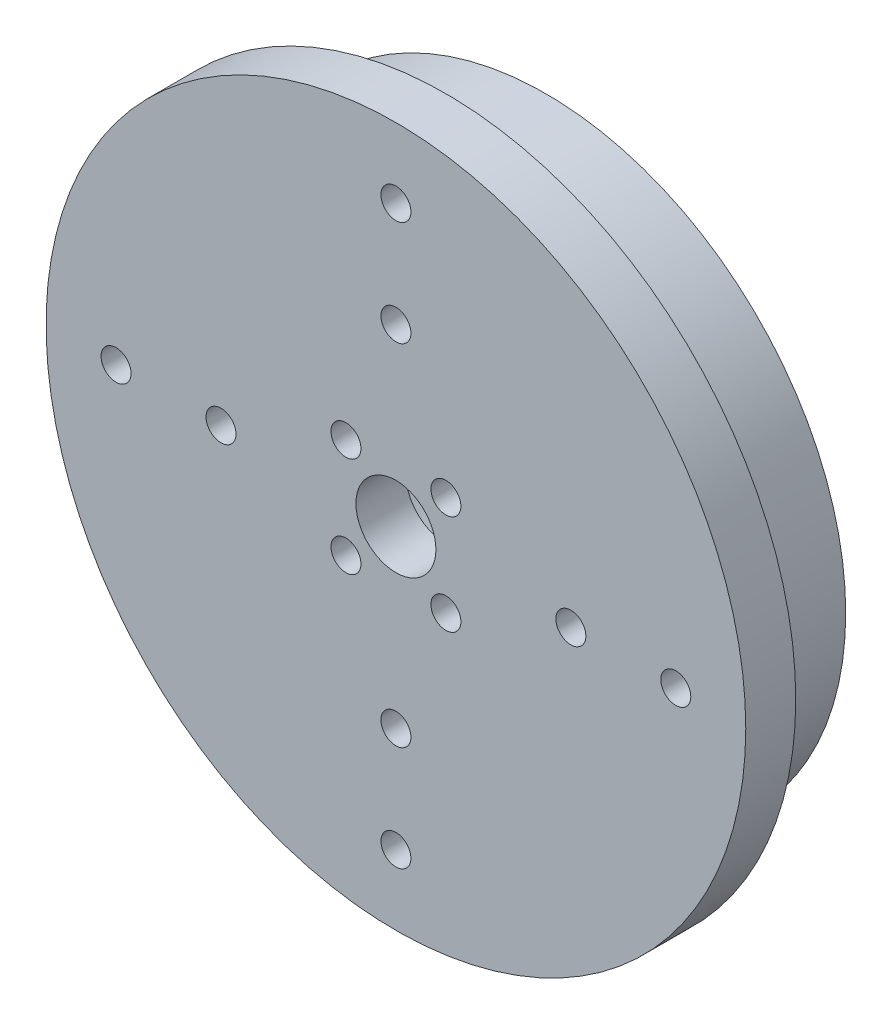
from build123d import *
from build123d.topology import SkipClean

# Parameters (mm, degrees)
SKETCH_1_R          = 35
SKETCH_1_R_2        = 30
SKETCH_1_R_3        = 1.5
SKETCH_1_R_4        = 26
SKETCH_1_R_5        = 20
SKETCH_1_R_6        = 15
SKETCH_1_R_7        = 12.5
EXTRUDE_1_DEPTH     = 5
EXTRUDE_START       = 10
SKETCH_2_R          = 30
SKETCH_2_R_2        = 26
SKETCH_2_R_3        = 1.5
SKETCH_2_R_4        = 20
SKETCH_2_R_5        = 15
EXTRUDE_2_DEPTH     = 10
SKETCH_3_R          = 4
SKETCH_3_R_2        = 1.5
CUT_EXTRUDE_1_DEPTH = 10


with BuildPart() as part:
    # 草图1 → 凸台-拉伸1 (new body)
    # profile 1 of 6: a face of its own
    with BuildSketch(Plane.XY):
        Circle(SKETCH_1_R)
        Circle(SKETCH_1_R_2, mode=Mode.SUBTRACT)
    # profile 2 of 6: a face of its own
    with BuildSketch(Plane.XY):
        Circle(SKETCH_1_R_2)
        with Locations((-28, 0)):
            Circle(SKETCH_1_R_3, mode=Mode.SUBTRACT)
        with Locations((0, -28)):
            Circle(SKETCH_1_R_3, mode=Mode.SUBTRACT)
        with Locations((28, 0)):
            Circle(SKETCH_1_R_3, mode=Mode.SUBTRACT)
        with Locations((0, 28)):
            Circle(SKETCH_1_R_3, mode=Mode.SUBTRACT)
        Circle(SKETCH_1_R_4, mode=Mode.SUBTRACT)
    # profile 3 of 6: a face of its own
    with BuildSketch(Plane.XY):
        Circle(SKETCH_1_R_4)
        Circle(SKETCH_1_R_5, mode=Mode.SUBTRACT)
    # profile 4 of 6: a face of its own
    with BuildSketch(Plane.XY):
        Circle(SKETCH_1_R_5)
        with Locations((-17.5, 0)):
            Circle(SKETCH_1_R_3, mode=Mode.SUBTRACT)
        with Locations((0, -17.5)):
            Circle(SKETCH_1_R_3, mode=Mode.SUBTRACT)
        with Locations((17.5, 0)):
            Circle(SKETCH_1_R_3, mode=Mode.SUBTRACT)
        with Locations((0, 17.5)):
            Circle(SKETCH_1_R_3, mode=Mode.SUBTRACT)
        Circle(SKETCH_1_R_6, mode=Mode.SUBTRACT)
    # profile 5 of 6: a face of its own
    with BuildSketch(Plane.XY):
        Circle(SKETCH_1_R_6)
        Circle(SKETCH_1_R_7, mode=Mode.SUBTRACT)
    # profile 6 of 6: a face of its own
    with BuildSketch(Plane.XY):
        Circle(SKETCH_1_R_7)
    extrude(amount=EXTRUDE_1_DEPTH)

    # 草图2 → 凸台-拉伸2 (add)
    # profile 1 of 2: a face of its own
    with SkipClean():  # the faces are left unmerged after this step: merging them gives an invalid solid
        with BuildSketch(Plane(origin=(0, 0, 0), x_dir=(-1, 0, 0), z_dir=(0, 0, -1)).offset(EXTRUDE_START)):
            with Locations(Location((0, 0, 0), (0, 0, 180))):
                Circle(SKETCH_2_R)
            Circle(SKETCH_2_R_2, mode=Mode.SUBTRACT)
            with Locations((0, -28)):
                Circle(SKETCH_2_R_3, mode=Mode.SUBTRACT)
            with Locations((0, 28)):
                Circle(SKETCH_2_R_3, mode=Mode.SUBTRACT)
            with Locations((-28, 0)):
                Circle(SKETCH_2_R_3, mode=Mode.SUBTRACT)
            with Locations((28, 0)):
                Circle(SKETCH_2_R_3, mode=Mode.SUBTRACT)
        # profile 2 of 2: a face of its own
        with BuildSketch(Plane(origin=(0, 0, 0), x_dir=(-1, 0, 0), z_dir=(0, 0, -1)).offset(EXTRUDE_START)):
            with Locations(Location((0, 0, 0), (0, 0, 180))):
                Circle(SKETCH_2_R_4)
            Circle(SKETCH_2_R_5, mode=Mode.SUBTRACT)
            with Locations((17.5, 0)):
                Circle(SKETCH_2_R_3, mode=Mode.SUBTRACT)
            with Locations((-17.5, 0)):
                Circle(SKETCH_2_R_3, mode=Mode.SUBTRACT)
            with Locations((0, 17.5)):
                Circle(SKETCH_2_R_3, mode=Mode.SUBTRACT)
            with Locations((0, -17.5)):
                Circle(SKETCH_2_R_3, mode=Mode.SUBTRACT)
        extrude(amount=-EXTRUDE_2_DEPTH)

    # 草图3 → 切除-拉伸1 (cut)
    with SkipClean():  # the faces are left unmerged after this step: merging them gives an invalid solid
        with BuildSketch(Plane(origin=(0, 0, 0), x_dir=(-1, 0, 0), z_dir=(0, 0, -1))):
            with BuildLine():
                ThreePointArc((-3.5, 5), (-6.060660172, 6.060660172), (-5, 3.5))
                Line((-5, 3.5), (-5, 5))
                Line((-5, 5), (-3.5, 5))
            make_face()
            with BuildLine():
                Line((-5, 5), (-5, 3.5))
                ThreePointArc((-5, 3.5), (-3.939339828, 3.939339828), (-3.5, 5))
                Line((-3.5, 5), (-5, 5))
            make_face()
            Circle(SKETCH_3_R)
            with Locations((-5, -5)):
                Circle(SKETCH_3_R_2)
            with Locations((5, -5)):
                Circle(SKETCH_3_R_2)
            with Locations((5, 5)):
                Circle(SKETCH_3_R_2)
        extrude(amount=-CUT_EXTRUDE_1_DEPTH, mode=Mode.SUBTRACT)


solid = part.part
